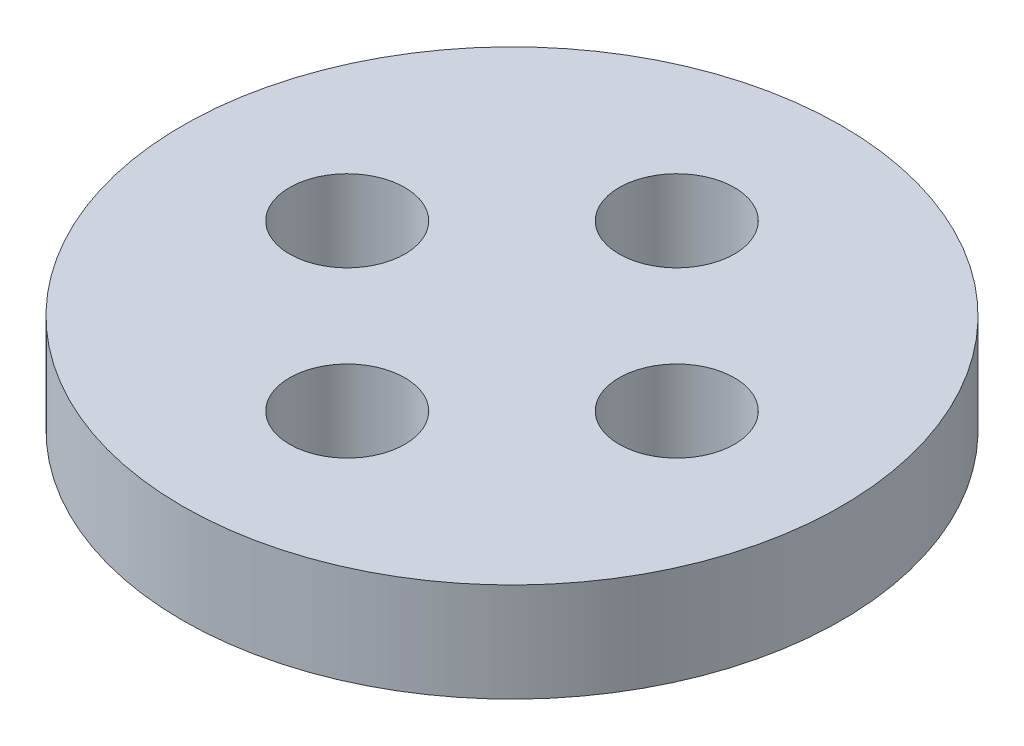
from build123d import *

# Parameters (mm, degrees)
SKETCH1_R           = 10
SKETCH1_R_2         = 1.75
BOSS_EXTRUDE1_DEPTH = 3


with BuildPart() as part:
    # Sketch1 → Boss-Extrude1 (new body)
    with BuildSketch(Plane(origin=(0, 0, 0), x_dir=(1, 0, 0), z_dir=(0, 1, 0))):
        with Locations(Location((0, 0, 0), (0, 0, 270))):
            Circle(SKETCH1_R)
        with Locations(Location((0, 5, 0), (0, 0, 270))):
            Circle(SKETCH1_R_2, mode=Mode.SUBTRACT)
        with Locations(Location((5, 0, 0), (0, 0, 270))):
            Circle(SKETCH1_R_2, mode=Mode.SUBTRACT)
        with Locations(Location((0, -5, 0), (0, 0, 270))):
            Circle(SKETCH1_R_2, mode=Mode.SUBTRACT)
        with Locations(Location((-5, 0, 0), (0, 0, 270))):
            Circle(SKETCH1_R_2, mode=Mode.SUBTRACT)
    extrude(amount=BOSS_EXTRUDE1_DEPTH)


solid = part.part
